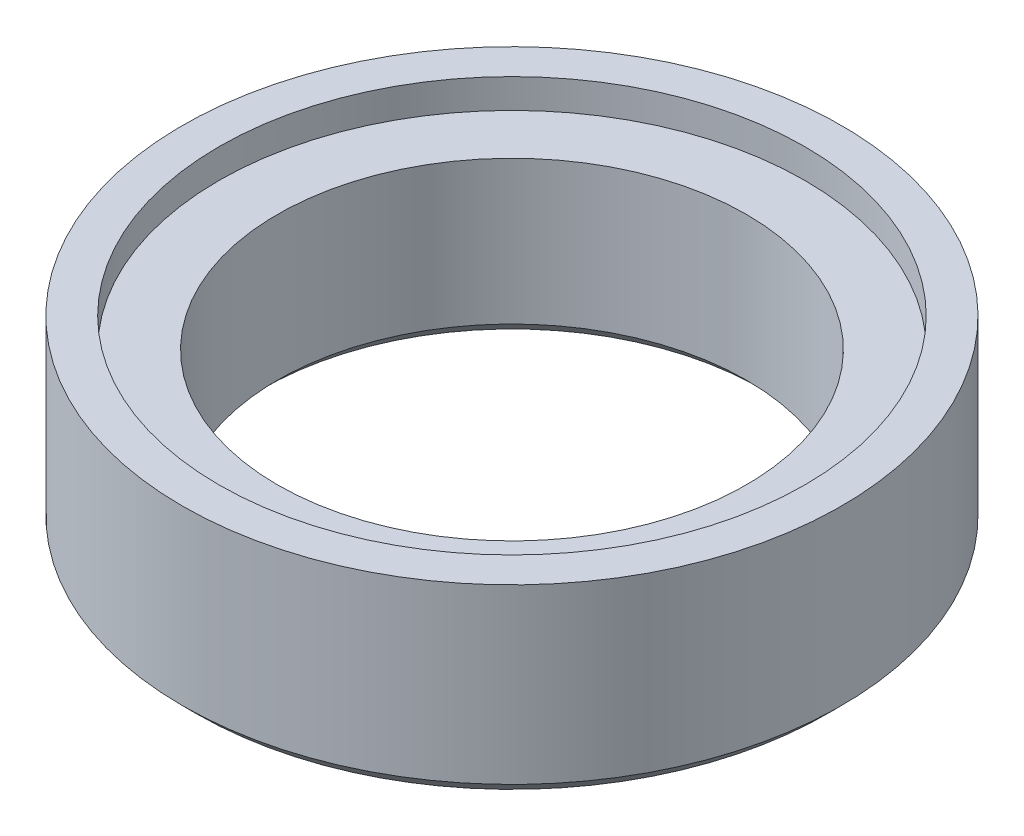
from build123d import *

# Parameters (mm, degrees)
SKETCH1_R           = 11.25
SKETCH1_R_2         = 8
BOSS_EXTRUDE1_DEPTH = 6.4
SKETCH2_R           = 10
CUT_EXTRUDE1_DEPTH  = 1
CHAMFER1_SIZE       = 0.5


with BuildPart() as part:
    # Sketch1 → Boss-Extrude1 (new body)
    with BuildSketch(Plane(origin=(0, 0, 0), x_dir=(1, 0, 0), z_dir=(0, 1, 0))):
        with Locations(Location((0, 0, 0), (0, 0, 270))):
            Circle(SKETCH1_R)
        with Locations(Location((0, 0, 0), (0, 0, 270))):
            Circle(SKETCH1_R_2, mode=Mode.SUBTRACT)
    extrude(amount=BOSS_EXTRUDE1_DEPTH)

    # Sketch2 → Cut-Extrude1 (cut)
    with BuildSketch(Plane(origin=(0, 6.4, 0), x_dir=(1, 0, 0), z_dir=(0, 1, 0))):
        with Locations(Location((0, 0, 0), (0, 0, 270))):
            Circle(SKETCH2_R)
    extrude(amount=-CUT_EXTRUDE1_DEPTH, mode=Mode.SUBTRACT)

    # Chamfer1
    chamfer1_edges = [part.edges().sort_by_distance(p)[0] for p in [
        (0, 0, -11.25),
        (0, 0, -8),
    ]]
    chamfer(chamfer1_edges, length=CHAMFER1_SIZE)


solid = part.part
